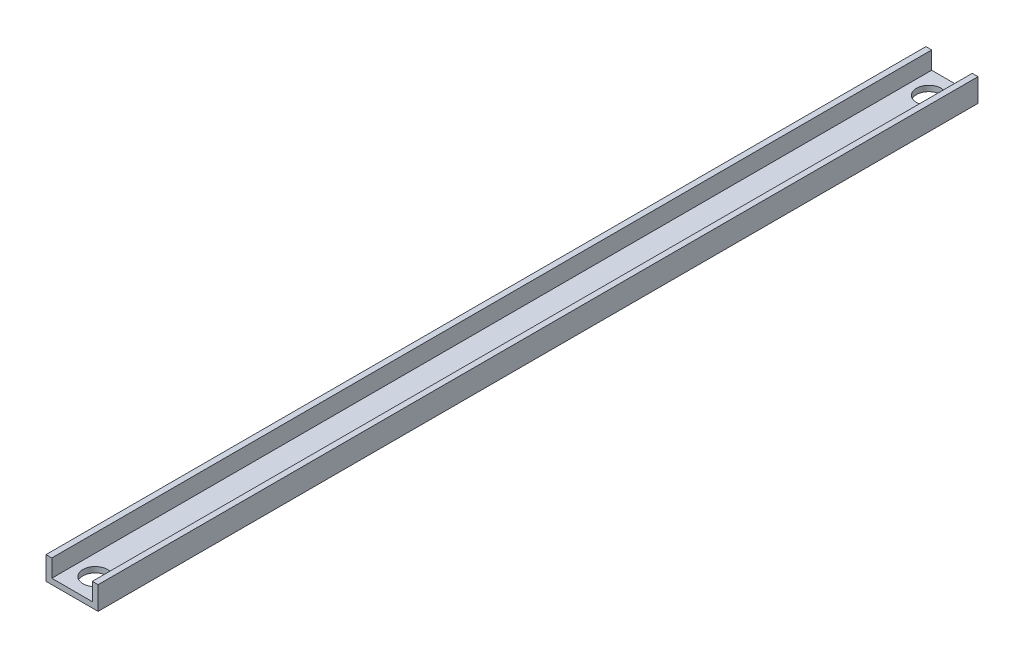
from build123d import *

# Parameters (mm, degrees)
BOSS_EXTRUDE1_DEPTH     = 120.65
F_1_4_CLEARANCE_HOLE1_D = 6.7564


with BuildPart() as part:
    # Sketch2 → Boss-Extrude1 (new, symmetric)
    with BuildSketch(Plane.XY):
        Polygon((-7.14375, 3.175), (-7.14375, -3.175), (7.14375, -3.175), (7.14375, 3.175), (5.55625, 3.175), (5.55625, -1.651), (-5.55625, -1.651), (-5.55625, 3.175), align=None)
    extrude(amount=BOSS_EXTRUDE1_DEPTH, both=True)

    # 1/4 Clearance Hole1 (through all)
    with Locations(Plane(origin=(0, -1.651, 0), x_dir=(-1, 0, 0), z_dir=(0, 1, 0))):
        with Locations((0, -114.3), (0, 114.3)):
            Hole(F_1_4_CLEARANCE_HOLE1_D / 2)


solid = part.part
